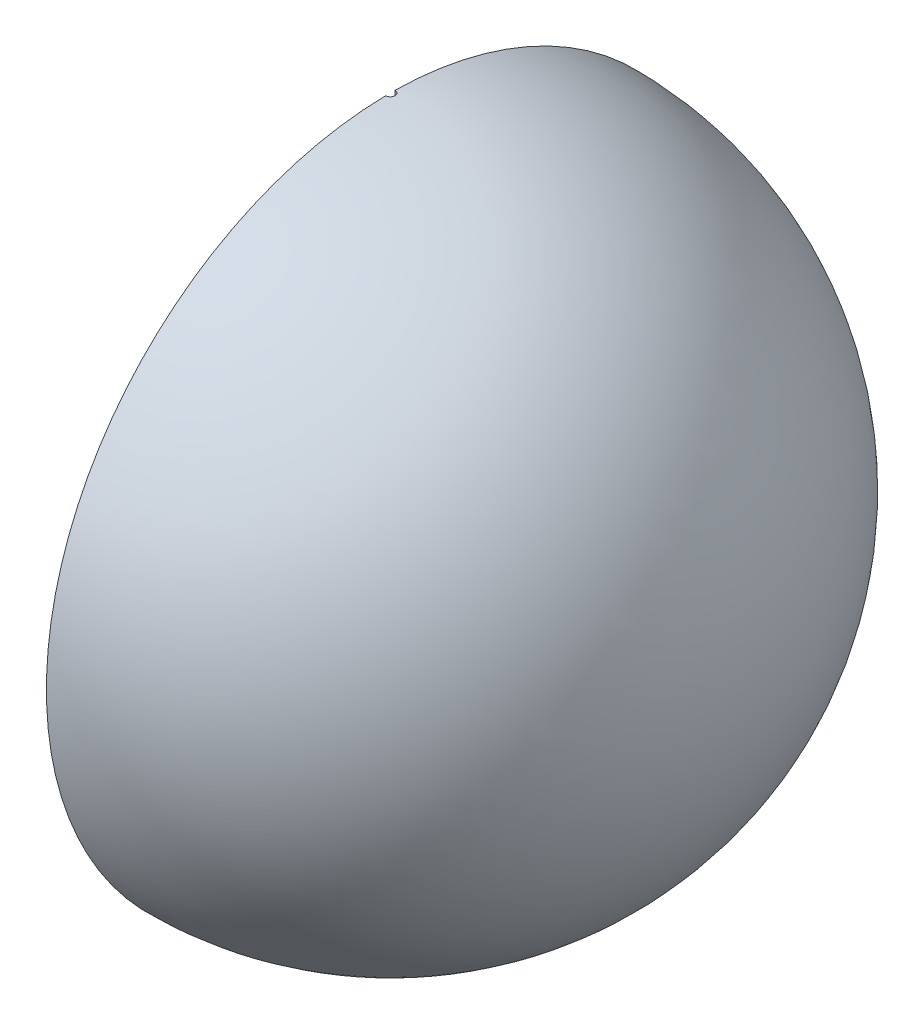
from build123d import *

# Parameters (mm, degrees)
REVOLVE1_ANGLE     = 180
SKETCH3_R          = 0.541850366
CUT_EXTRUDE1_DEPTH = 41.5


with BuildPart() as part:
    # Sketch2 → Revolve1 (revolve)
    with BuildSketch(Plane(origin=(0, 0, 0), x_dir=(0, 0, -1), z_dir=(1, 0, 0))):
        with BuildLine():
            Line((0, 40.005094841), (0.09926792, -40.00497168))
            ThreePointArc((0.09926792, -40.00497168), (40.00506405, 0.049633998), (0, 40.005094841))
        make_face()
    revolve(axis=Axis((0, 40.005094841, 0), (0, -0.9999992303414782, -0.0012406919243473811)), revolution_arc=REVOLVE1_ANGLE)

    # Sketch3 → Cut-Extrude1 (cut, symmetric)
    with BuildSketch(Plane(origin=(0, 0, 0), x_dir=(1, 0, 0), z_dir=(0, 1, 0))):
        Circle(SKETCH3_R)
    extrude(amount=CUT_EXTRUDE1_DEPTH, both=True, mode=Mode.SUBTRACT)


solid = part.part
